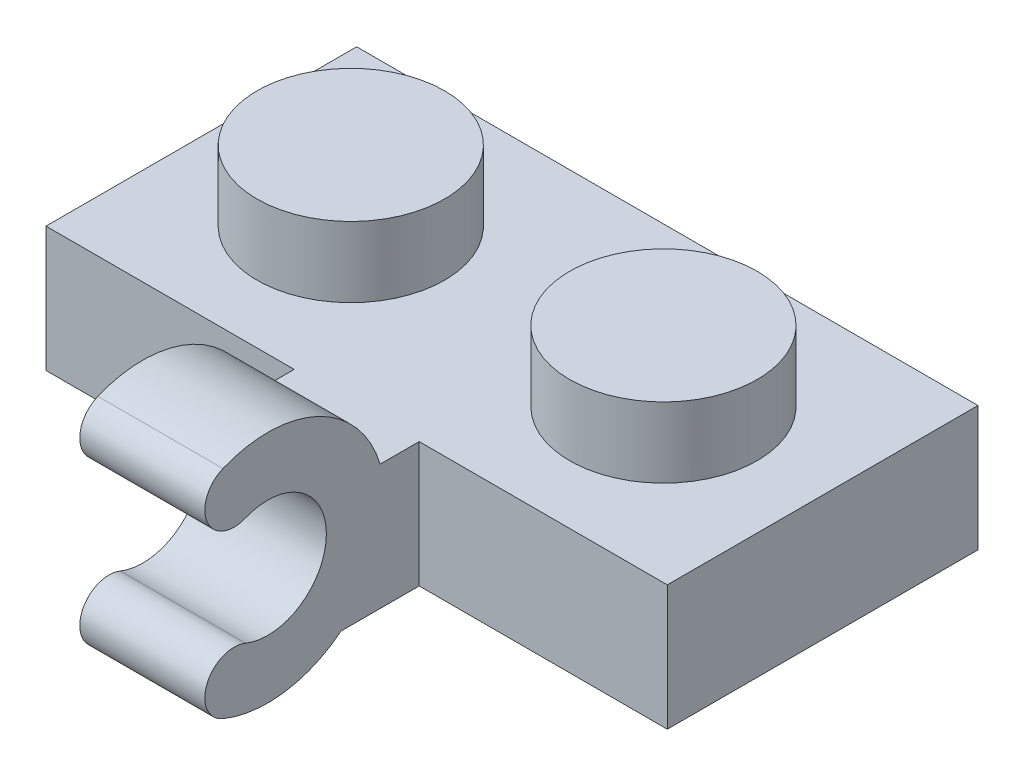
from build123d import *

# Parameters (mm, degrees)
SKETCH1_W           = 15.9
SKETCH1_H           = 7.95
BOSS_EXTRUDE1_DEPTH = 3.2
SHELL1_T            = -1.2
SKETCH3_R           = 1.5
SKETCH3_R_2         = 0.5
BOSS_EXTRUDE3_DEPTH = 2
SKETCH4_R           = 2.4
BOSS_EXTRUDE4_DEPTH = 1.8
LPATTERN1_COUNT     = 2
LPATTERN1_PITCH     = 8
BOSS_EXTRUDE5_DEPTH = 1.6


with BuildPart() as part:
    # Sketch1 → Boss-Extrude1 (new body)
    with BuildSketch(Plane(origin=(0, 0, 0), x_dir=(1, 0, 0), z_dir=(0, 1, 0))):
        Rectangle(SKETCH1_W, SKETCH1_H)
    extrude(amount=BOSS_EXTRUDE1_DEPTH)

    # Shell1
    shell1_openings = [part.faces().sort_by_distance(p)[0] for p in [
        (0, 0, 0),
    ]]
    offset(amount=SHELL1_T, openings=shell1_openings, kind=Kind.INTERSECTION)

    # Sketch3 → Boss-Extrude3 (add)
    with BuildSketch(Plane.XZ.offset(-2)):
        with Locations(Location((0, 0, 0), (0, 0, 270))):
            Circle(SKETCH3_R)
        with Locations(Location((0, 0, 0), (0, 0, 270))):
            Circle(SKETCH3_R_2, mode=Mode.SUBTRACT)
    extrude(amount=BOSS_EXTRUDE3_DEPTH)

    # Sketch4 → Boss-Extrude4 (add)
    with BuildSketch(Plane(origin=(0, 3.2, 0), x_dir=(1, 0, 0), z_dir=(0, 1, 0))):
        with Locations(Location((-4.05, -0.075, 0), (0, 0, 90))):
            Circle(SKETCH4_R)
    boss_extrude4 = extrude(amount=BOSS_EXTRUDE4_DEPTH)

    # LPattern1: Boss-Extrude4 ×2
    with Locations(*[(i * LPATTERN1_PITCH, 0, 0) for i in range(1, LPATTERN1_COUNT)]):
        add(boss_extrude4)

    # Sketch5 → Boss-Extrude5 (add, symmetric)
    with BuildSketch(Plane(origin=(0, 0, 0), x_dir=(0, 0, -1), z_dir=(1, 0, 0))):
        with BuildLine():
            Line((-3.975, 0), (-5.975, 0))
            ThreePointArc((-5.975, 0), (-7.427655013, -0.628062458), (-8.997768861, -0.429539046))
            ThreePointArc((-8.997768861, -0.429539046), (-9.403665936, 0.550383177), (-8.423743712, 0.956280252))
            ThreePointArc((-8.423743712, 0.956280252), (-6.349718564, 2.342099551), (-8.423743712, 3.72791885))
            ThreePointArc((-8.423743712, 3.72791885), (-9.403665936, 4.133815925), (-8.997768861, 5.113738149))
            ThreePointArc((-8.997768861, 5.113738149), (-6.560942303, 5.051168718), (-4.975, 3.2))
            Line((-4.975, 3.2), (-3.975, 3.2))
            Line((-3.975, 3.2), (-3.975, 0))
        make_face()
    extrude(amount=BOSS_EXTRUDE5_DEPTH, both=True)


solid = part.part
